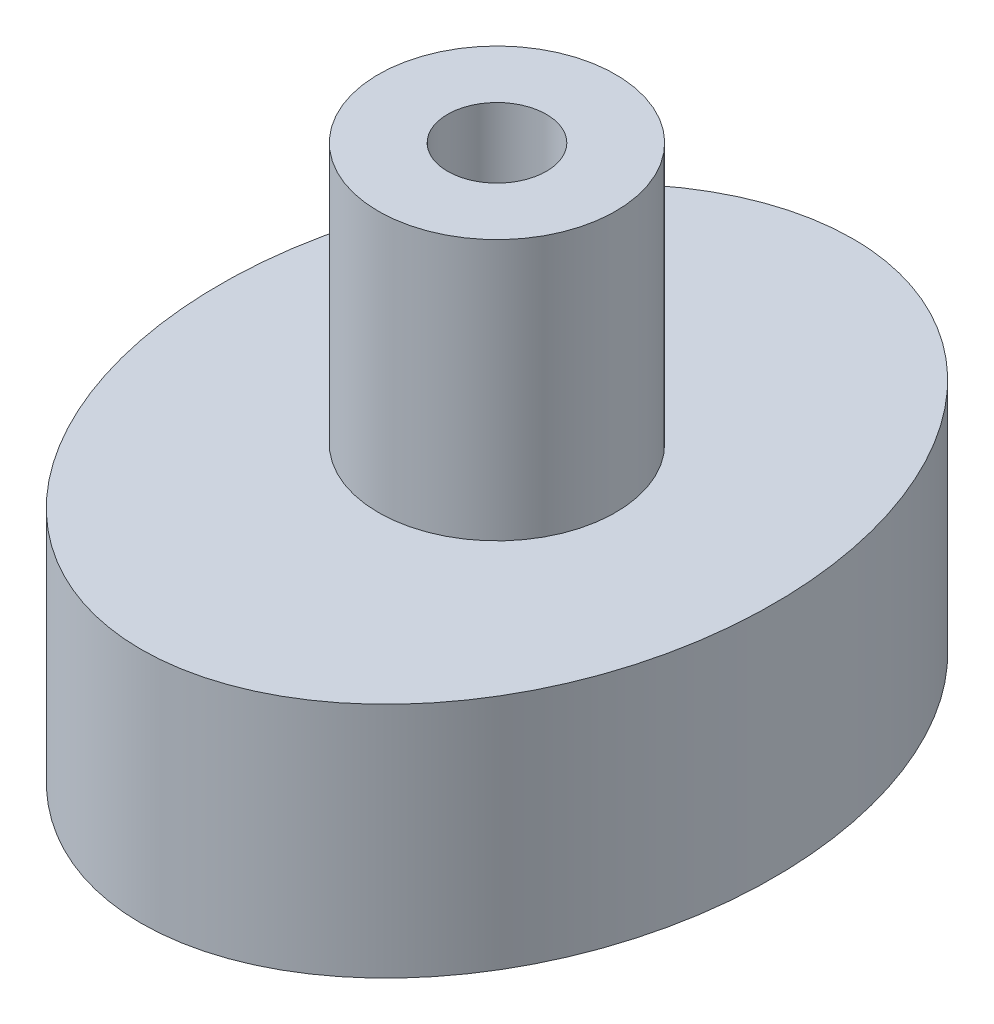
from build123d import *

# Parameters (mm, degrees)
SKETCH1_R               = 25.4
BOSS_EXTRUDE1_DEPTH     = 5.842
SKETCH2_RX              = 45.72
SKETCH2_RY              = 35.56
BOSS_EXTRUDE2_DEPTH     = 30.48
SKETCH3_R               = 15.24
BOSS_EXTRUDE3_DEPTH     = 33.528
CUT_EXTRUDE2_DEPTH      = 91.740589044
CUT_EXTRUDE2_DEPTH_BACK = 91.740589044
SKETCH4_R               = 6.35


with BuildPart() as part:
    # Sketch1 → Boss-Extrude1 (new body)
    with BuildSketch(Plane(origin=(0, 0, 0), x_dir=(1, 0, 0), z_dir=(0, 1, 0))):
        with Locations(Location((0, 0, 0), (0, 0, 270))):
            Circle(SKETCH1_R)
    extrude(amount=BOSS_EXTRUDE1_DEPTH)

    # Sketch2 → Boss-Extrude2 (add)
    with BuildSketch(Plane(origin=(0, 5.842, 0), x_dir=(1, 0, 0), z_dir=(0, 1, 0))):
        with Locations(Location((0, 0), (0, 0, 90))):
            Ellipse(SKETCH2_RX, SKETCH2_RY)
    extrude(amount=BOSS_EXTRUDE2_DEPTH)

    # Sketch3 → Boss-Extrude3 (add)
    with BuildSketch(Plane(origin=(0, 36.322, 0), x_dir=(1, 0, 0), z_dir=(0, 1, 0))):
        with Locations(Location((0, 0, 0), (0, 0, 270))):
            Circle(SKETCH3_R)
    extrude(amount=BOSS_EXTRUDE3_DEPTH)

    # Sketch4 → Cut-Extrude2 (cut, two sides: drawn at the far end of the back side and taken through both)
    with BuildSketch(Plane(origin=(0, 0, 0), x_dir=(1, 0, 0), z_dir=(0, 1, 0)).offset(-CUT_EXTRUDE2_DEPTH_BACK)):
        with Locations(Location((0, 0, 0), (0, 0, 270))):
            Circle(SKETCH4_R)
    extrude(amount=CUT_EXTRUDE2_DEPTH + CUT_EXTRUDE2_DEPTH_BACK, mode=Mode.SUBTRACT)


solid = part.part
